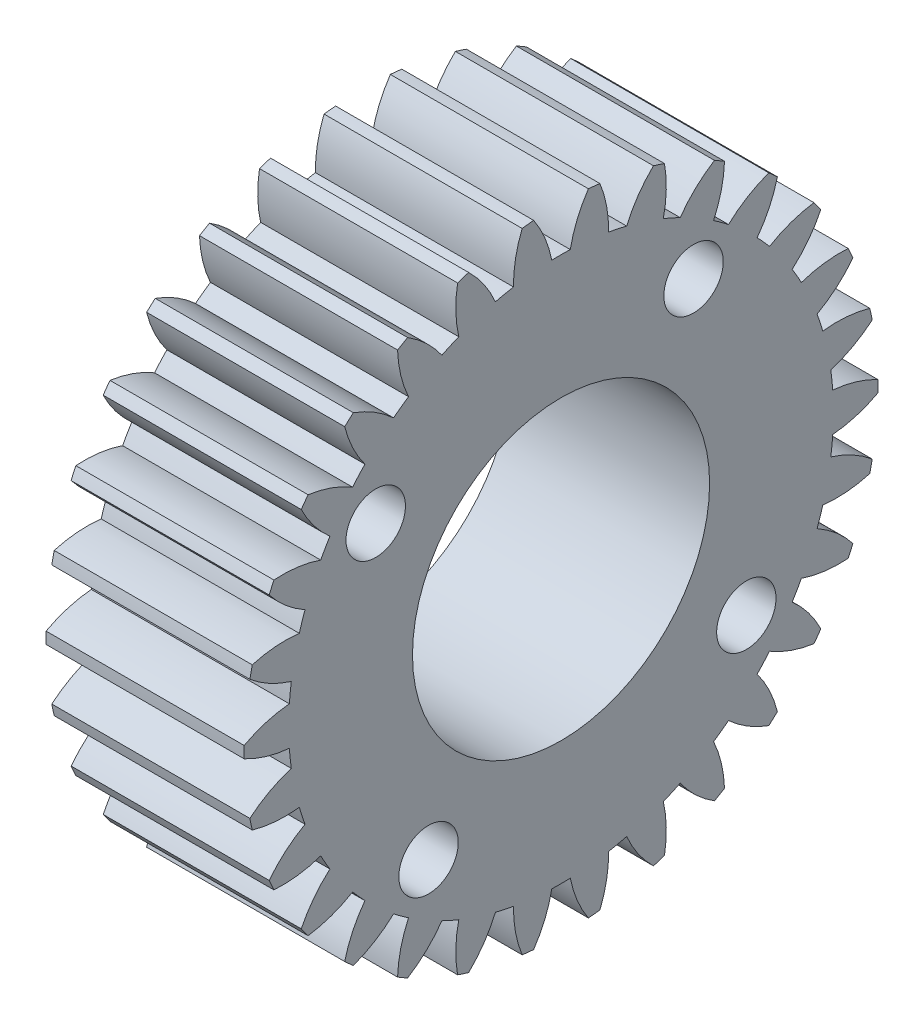
from build123d import *

# Parameters (mm, degrees)
BASPROSKE_W        = 10
BASPROSKE_H        = 16
TOOTHCUT_DEPTH     = 25.738633754
TEETHCUTS_COUNT    = 30
TEETHCUTS_ANGLE    = 348
BORSKE_R           = 7.5
BORE_DEPTH         = 50.0000508
SKETCH1_R          = 1.5
CUT_EXTRUDE1_DEPTH = 25.700050474


with BuildPart() as part:
    # BasProSke → Base-Revolve (revolve)
    with BuildSketch(Plane(origin=(0, 0, 0), x_dir=(1, 0, 0), z_dir=(0, 1, 0)), mode=Mode.PRIVATE) as base_revolve_sk:
        with Locations((5, 8)):
            Rectangle(BASPROSKE_W, BASPROSKE_H)
    revolve(base_revolve_sk.sketch.rotate(Axis((-10, 0, 0), (1, 0, 0)), 180), axis=Axis((-10, 0, 0), (1, 0, 0)))

    # TooCutSke → ToothCut (cut, through all)
    with BuildSketch(Plane(origin=(0, 0, 0), x_dir=(0, 0, -1), z_dir=(1, 0, 0))):
        with BuildLine():
            ThreePointArc((0.466400716, 13.741086979), (0, 13.749), (-0.466400716, 13.741086979))
            ThreePointArc((-0.466400716, 13.741086979), (-0.819142092, 14.899954875), (-1.3974676, 15.964351834))
            ThreePointArc((-1.3974676, 15.964351834), (0, 16.0254), (1.3974676, 15.964351834))
            ThreePointArc((1.3974676, 15.964351834), (0.819142092, 14.899954875), (0.466400716, 13.741086979))
        make_face()
    toothcut = extrude(amount=TOOTHCUT_DEPTH, mode=Mode.SUBTRACT)

    # TeethCuts: ToothCut ×30 about axis
    teethcuts_axis = Axis((-10, 0, 0), (1, 0, 0))
    for i in range(1, TEETHCUTS_COUNT):
        add(toothcut.rotate(teethcuts_axis, i * TEETHCUTS_ANGLE / (TEETHCUTS_COUNT - 1)), mode=Mode.SUBTRACT)

    # BorSke → Bore (cut, symmetric)
    with BuildSketch(Plane(origin=(0, 0, 0), x_dir=(0, 0, -1), z_dir=(1, 0, 0))):
        with Locations(Location((0, 0, 0), (0, 0, 180))):
            Circle(BORSKE_R)
    extrude(amount=BORE_DEPTH, both=True, mode=Mode.SUBTRACT)

    # Sketch1 → Cut-Extrude1 (cut, through all)
    with BuildSketch(Plane.ZY):
        with Locations((6.689327089, -9.354298643)):
            Circle(SKETCH1_R)
        with Locations((9.354298643, 6.689327088)):
            Circle(SKETCH1_R)
        with Locations((-6.689327088, 9.354298643)):
            Circle(SKETCH1_R)
        with Locations((-9.354298643, -6.689327089)):
            Circle(SKETCH1_R)
    extrude(amount=-CUT_EXTRUDE1_DEPTH, mode=Mode.SUBTRACT)


solid = part.part
